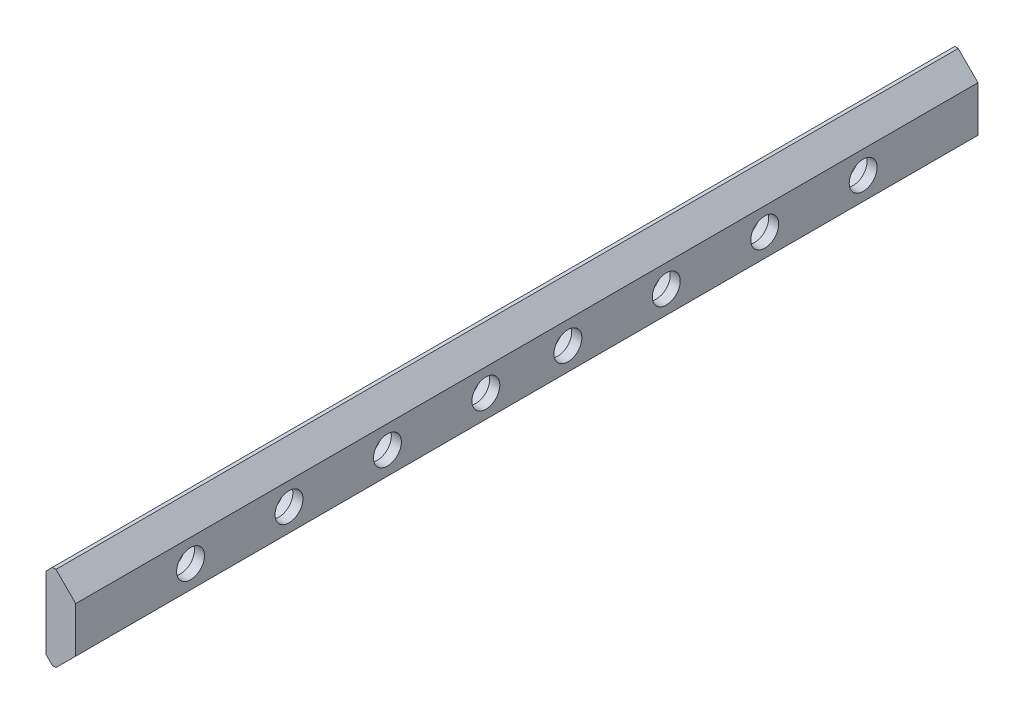
from build123d import *

# Parameters (mm, degrees)
BOSS_EXTRUDE2_DEPTH                                = 110
CHAMBRAGE_POUR_VIS_T_TE_RONDE_BOMB_E_M_D           = 3.4
CHAMBRAGE_POUR_VIS_T_TE_RONDE_BOMB_E_M_DEPTH       = 7
CHAMBRAGE_POUR_VIS_T_TE_RONDE_BOMB_E_M_CBORE_D     = 7
CHAMBRAGE_POUR_VIS_T_TE_RONDE_BOMB_E_M_CBORE_DEPTH = 2.4
CUT_EXTRUDE1_DEPTH                                 = 111.147379253
CHAMFER1_SIZE                                      = 0.3


with BuildPart() as part:
    # Sketch1 → Boss-Extrude2 (new body)
    with BuildSketch(Plane.XY):
        Polygon((-1.8125, 5.4), (-0.8125, 5.4), (1.8125, 2.775), (1.8125, -2.775), (-0.8125, -5.4), (-1.8125, -5.4), align=None)
    extrude(amount=BOSS_EXTRUDE2_DEPTH)

    # Chambrage pour vis _ t_te ronde bomb_e M
    with Locations(Plane.ZY.offset(1.8125)):
        with Locations((60, 0), (50, 0), (38, 0), (26, 0), (14, 0), (72, 0), (84, 0), (96, 0)):
            CounterBoreHole(CHAMBRAGE_POUR_VIS_T_TE_RONDE_BOMB_E_M_D / 2, CHAMBRAGE_POUR_VIS_T_TE_RONDE_BOMB_E_M_CBORE_D / 2, CHAMBRAGE_POUR_VIS_T_TE_RONDE_BOMB_E_M_CBORE_DEPTH, depth=CHAMBRAGE_POUR_VIS_T_TE_RONDE_BOMB_E_M_DEPTH)

    # Sketch2 → Cut-Extrude1 (cut, through all)
    with BuildSketch(Plane.XY.offset(110)):
        Polygon((-0.8125, 5.4), (-1.8125, 4.4), (-1.8125, 5.4), align=None)
        Polygon((-0.8125, -5.4), (-1.8125, -4.4), (-1.8125, -5.4), align=None)
    extrude(amount=-CUT_EXTRUDE1_DEPTH, mode=Mode.SUBTRACT)

    # Chamfer1
    chamfer1_edges = [part.edges().sort_by_distance(p)[0] for p in [
        (-0.8125, 5.4, 55),
        (-0.8125, -5.4, 55),
    ]]
    chamfer(chamfer1_edges, length=CHAMFER1_SIZE)


solid = part.part
